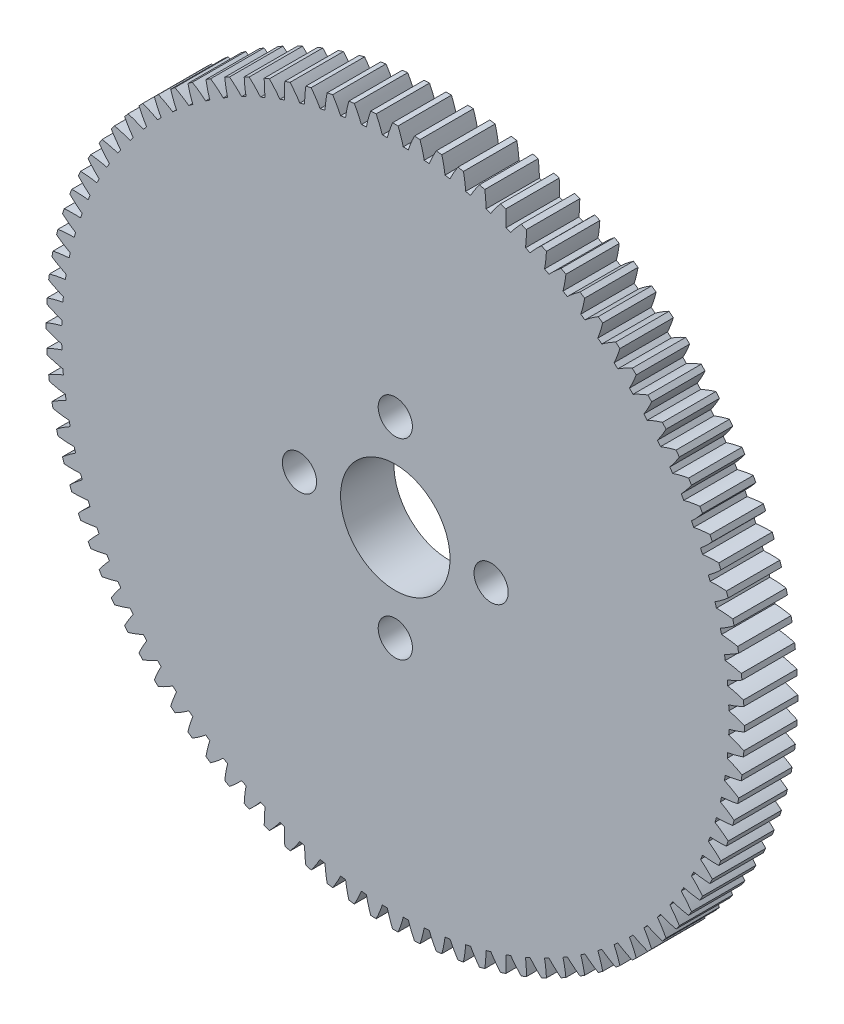
from build123d import *

# Parameters (mm, degrees)
BOSS_EXTRUDE1_DEPTH = 3.9
SKETCH2_R           = 4
SKETCH2_R_2         = 1.25
CUT_EXTRUDE1_DEPTH  = 37.271594327


with BuildPart() as part:
    # Sketch1 → Boss-Extrude1 (new body)
    with BuildSketch(Plane.XY.offset(4)):
        with BuildLine():
            Line((25.499201507, -0.201798183), (25.499201507, 0.201798183))
            ThreePointArc((25.499201507, 0.201798183), (24.94053741, 0.412222952), (24.368062617, 0.581506053))
            ThreePointArc((24.368062617, 0.581506053), (24.362972409, 0.765637253), (24.356490879, 0.949724728))
            ThreePointArc((24.356490879, 0.949724728), (24.917148309, 1.154763051), (25.46155567, 1.39970813))
            Line((25.46155567, 1.39970813), (25.436213645, 1.802508091))
            ThreePointArc((25.436213645, 1.802508091), (24.865439263, 1.977438825), (24.283464745, 2.110441895))
            ThreePointArc((24.283464745, 2.110441895), (24.266822887, 2.293890137), (24.248795199, 2.47720738))
            ThreePointArc((24.248795199, 2.47720738), (24.795471836, 2.717045077), (25.323424706, 2.995690434))
            Line((25.323424706, 2.995690434), (25.272840668, 3.396104322))
            ThreePointArc((25.272840668, 3.396104322), (24.692208588, 3.534850651), (24.103031131, 3.631048787))
            ThreePointArc((24.103031131, 3.631048787), (24.074903302, 3.813090085), (24.045400602, 3.994913625))
            ThreePointArc((24.045400602, 3.994913625), (24.575938965, 4.268604168), (25.085353753, 4.579850117))
            Line((25.085353753, 4.579850117), (25.009727335, 4.976297682))
            ThreePointArc((25.009727335, 4.976297682), (24.421529045, 5.078312037), (23.827473865, 5.137325589))
            ThreePointArc((23.827473865, 5.137325589), (23.787971072, 5.317241509), (23.747109795, 5.496853772))
            ThreePointArc((23.747109795, 5.496853772), (24.25941609, 5.803317028), (24.748282369, 6.145935223))
            Line((24.748282369, 6.145935223), (24.647912034, 6.536851868))
            ThreePointArc((24.647912034, 6.536851868), (24.054468885, 6.601731644), (23.457880446, 6.623327714))
            ThreePointArc((23.457880446, 6.623327714), (23.407158588, 6.80040821), (23.355099994, 6.977100348))
            ThreePointArc((23.355099994, 6.977100348), (23.847152382, 7.315126847), (24.313540822, 7.687765132))
            Line((24.313540822, 7.687765132), (24.188822685, 8.071608086))
            ThreePointArc((24.188822685, 8.071608086), (23.592476726, 8.099097233), (22.995709489, 8.083190589))
            ThreePointArc((22.995709489, 8.083190589), (22.933968743, 8.256736806), (22.870918284, 8.429811496))
            ThreePointArc((22.870918284, 8.429811496), (23.340774859, 8.798067203), (23.782844836, 9.199254943))
            Line((23.782844836, 9.199254943), (23.634271104, 9.574509354))
            ThreePointArc((23.634271104, 9.574509354), (23.037375839, 9.564499385), (22.442784972, 9.511152805))
            ThreePointArc((22.442784972, 9.511152805), (22.370269001, 9.680479834), (22.296475507, 9.84925403))
            ThreePointArc((22.296475507, 9.84925403), (22.742281961, 10.246285607), (23.158288827, 10.674439498))
            Line((23.158288827, 10.674439498), (22.986445852, 11.039624408))
            ThreePointArc((22.986445852, 11.039624408), (22.391356955, 10.992154828), (21.801289037, 10.901578846))
            ThreePointArc((21.801289037, 10.901578846), (21.718284027, 11.066018431), (21.634038729, 11.229826058))
            ThreePointArc((21.634038729, 11.229826058), (22.054035666, 11.654066602), (22.442337633, 12.107496917))
            Line((22.442337633, 12.107496917), (22.2479036, 12.461171109))
            ThreePointArc((22.2479036, 12.461171109), (21.656969615, 12.376429258), (21.073753374, 12.248981335))
            ThreePointArc((21.073753374, 12.248981335), (20.980586908, 12.407884509), (20.886222283, 12.566079093))
            ThreePointArc((20.886222283, 12.566079093), (21.278752168, 13.015854321), (21.637816784, 13.492771577))
            Line((21.637816784, 13.492771577), (21.421559037, 13.833539259))
            ThreePointArc((21.421559037, 13.833539259), (20.837112109, 13.711859575), (20.263049233, 13.548042691))
            ThreePointArc((20.263049233, 13.548042691), (20.160088998, 13.700782335), (20.055977459, 13.852739554))
            ThreePointArc((20.055977459, 13.852739554), (20.419491156, 14.326274409), (20.747901358, 14.824796431))
            Line((20.747901358, 14.824796431), (20.510673366, 15.151312751))
            ThreePointArc((20.510673366, 15.151312751), (19.935020042, 14.993175447), (19.372376095, 14.793636112))
            ThreePointArc((19.372376095, 14.793636112), (19.260028427, 14.939609433), (19.146580856, 15.084729581))
            ThreePointArc((19.146580856, 15.084729581), (19.479643742, 15.580155238), (19.776103444, 16.098314587))
            Line((19.776103444, 16.098314587), (19.518841438, 16.409290932))
            ThreePointArc((19.518841438, 16.409290932), (18.954253558, 16.215320106), (18.405249039, 15.98084581))
            ThreePointArc((18.405249039, 15.98084581), (18.283957322, 16.119476717), (18.161621444, 16.257187072))
            ThreePointArc((18.161621444, 16.257187072), (18.462919073, 16.772548311), (18.726258285, 17.30830005))
            Line((18.726258285, 17.30830005), (18.449977561, 17.60250914))
            ThreePointArc((18.449977561, 17.60250914), (17.898683294, 17.373470304), (17.365484873, 17.104986411))
            ThreePointArc((17.365484873, 17.104986411), (17.235727791, 17.235727791), (17.104986411, 17.365484873))
            ThreePointArc((17.104986411, 17.365484873), (17.373329697, 17.898747799), (17.60250914, 18.449977561))
            Line((17.60250914, 18.449977561), (17.30830005, 18.726258285))
            ThreePointArc((17.30830005, 18.726258285), (16.772475105, 18.463055352), (16.257187072, 18.161621444))
            ThreePointArc((16.257187072, 18.161621444), (16.119476717, 18.283957322), (15.98084581, 18.405249039))
            ThreePointArc((15.98084581, 18.405249039), (16.215175727, 18.954309106), (16.409290932, 19.518841438))
            Line((16.409290932, 19.518841438), (16.098314587, 19.776103444))
            ThreePointArc((16.098314587, 19.776103444), (15.580073619, 19.479775155), (15.084729581, 19.146580856))
            ThreePointArc((15.084729581, 19.146580856), (14.939609433, 19.260028427), (14.793636112, 19.372376095))
            ThreePointArc((14.793636112, 19.372376095), (14.993027865, 19.935066415), (15.151312751, 20.510673366))
            Line((15.151312751, 20.510673366), (14.824796431, 20.747901358))
            ThreePointArc((14.824796431, 20.747901358), (14.3261847, 20.419617185), (13.852739554, 20.055977459))
            ThreePointArc((13.852739554, 20.055977459), (13.700782335, 20.160088998), (13.548042691, 20.263049233))
            ThreePointArc((13.548042691, 20.263049233), (13.711709373, 20.837149124), (13.833539259, 21.421559037))
            Line((13.833539259, 21.421559037), (13.492771577, 21.637816784))
            ThreePointArc((13.492771577, 21.637816784), (13.015756876, 21.278872315), (12.566079093, 20.886222283))
            ThreePointArc((12.566079093, 20.886222283), (12.407884509, 20.980586908), (12.248981335, 21.073753374))
            ThreePointArc((12.248981335, 21.073753374), (12.376277027, 21.656997125), (12.461171109, 22.2479036))
            Line((12.461171109, 22.2479036), (12.107496917, 22.442337633))
            ThreePointArc((12.107496917, 22.442337633), (11.653961805, 22.054149458), (11.229826058, 21.634038729))
            ThreePointArc((11.229826058, 21.634038729), (11.066018431, 21.718284027), (10.901578846, 21.801289037))
            ThreePointArc((10.901578846, 21.801289037), (10.992001171, 22.391374853), (11.039624408, 22.986445852))
            Line((11.039624408, 22.986445852), (10.674439498, 23.158288827))
            ThreePointArc((10.674439498, 23.158288827), (10.246173871, 22.742388948), (9.84925403, 22.296475507))
            ThreePointArc((9.84925403, 22.296475507), (9.680479834, 22.370269001), (9.511152805, 22.442784972))
            ThreePointArc((9.511152805, 22.442784972), (9.564344907, 23.037384054), (9.574509354, 23.634271104))
            Line((9.574509354, 23.634271104), (9.199254943, 23.782844836))
            ThreePointArc((9.199254943, 23.782844836), (8.79794897, 23.340874619), (8.429811496, 22.870918284))
            ThreePointArc((8.429811496, 22.870918284), (8.256736806, 22.933968743), (8.083190589, 22.995709489))
            ThreePointArc((8.083190589, 22.995709489), (8.098942544, 23.592475224), (8.071608086, 24.188822685))
            Line((8.071608086, 24.188822685), (7.687765132, 24.313540822))
            ThreePointArc((7.687765132, 24.313540822), (7.315002584, 23.847244521), (6.977100348, 23.355099994))
            ThreePointArc((6.977100348, 23.355099994), (6.80040821, 23.407158588), (6.623327714, 23.457880446))
            ThreePointArc((6.623327714, 23.457880446), (6.601577355, 24.054457674), (6.536851868, 24.647912034))
            Line((6.536851868, 24.647912034), (6.145935223, 24.748282369))
            ThreePointArc((6.145935223, 24.748282369), (5.803187224, 24.259500244), (5.496853772, 23.747109795))
            ThreePointArc((5.496853772, 23.747109795), (5.317241509, 23.787971072), (5.137325589, 23.827473865))
            ThreePointArc((5.137325589, 23.827473865), (5.078158755, 24.421508168), (4.976297682, 25.009727335))
            Line((4.976297682, 25.009727335), (4.579850117, 25.085353753))
            ThreePointArc((4.579850117, 25.085353753), (4.268469336, 24.576014803), (3.994913625, 24.045400602))
            ThreePointArc((3.994913625, 24.045400602), (3.813090085, 24.074903302), (3.631048787, 24.103031131))
            ThreePointArc((3.631048787, 24.103031131), (3.534698983, 24.692178127), (3.396104322, 25.272840668))
            Line((3.396104322, 25.272840668), (2.995690434, 25.323424706))
            ThreePointArc((2.995690434, 25.323424706), (2.71690575, 24.795539059), (2.47720738, 24.248795199))
            ThreePointArc((2.47720738, 24.248795199), (2.293890137, 24.266822887), (2.110441895, 24.283464745))
            ThreePointArc((2.110441895, 24.283464745), (1.97728937, 24.865399339), (1.802508091, 25.436213645))
            Line((1.802508091, 25.436213645), (1.39970813, 25.46155567))
            ThreePointArc((1.39970813, 25.46155567), (1.154619777, 24.91720665), (0.949724728, 24.356490879))
            ThreePointArc((0.949724728, 24.356490879), (0.765637253, 24.362972409), (0.581506053, 24.368062617))
            ThreePointArc((0.581506053, 24.368062617), (0.412076298, 24.94048818), (0.201798183, 25.499201507))
            Line((0.201798183, 25.499201507), (-0.201798183, 25.499201507))
            ThreePointArc((-0.201798183, 25.499201507), (-0.412222952, 24.94053741), (-0.581506053, 24.368062617))
            ThreePointArc((-0.581506053, 24.368062617), (-0.765637253, 24.362972409), (-0.949724728, 24.356490879))
            ThreePointArc((-0.949724728, 24.356490879), (-1.154763051, 24.917148309), (-1.39970813, 25.46155567))
            Line((-1.39970813, 25.46155567), (-1.802508091, 25.436213645))
            ThreePointArc((-1.802508091, 25.436213645), (-1.977438825, 24.865439263), (-2.110441895, 24.283464745))
            ThreePointArc((-2.110441895, 24.283464745), (-2.293890137, 24.266822887), (-2.47720738, 24.248795199))
            ThreePointArc((-2.47720738, 24.248795199), (-2.717045077, 24.795471836), (-2.995690434, 25.323424706))
            Line((-2.995690434, 25.323424706), (-3.396104322, 25.272840668))
            ThreePointArc((-3.396104322, 25.272840668), (-3.534850651, 24.692208588), (-3.631048787, 24.103031131))
            ThreePointArc((-3.631048787, 24.103031131), (-3.813090085, 24.074903302), (-3.994913625, 24.045400602))
            ThreePointArc((-3.994913625, 24.045400602), (-4.268604168, 24.575938965), (-4.579850117, 25.085353753))
            Line((-4.579850117, 25.085353753), (-4.976297682, 25.009727335))
            ThreePointArc((-4.976297682, 25.009727335), (-5.078312037, 24.421529045), (-5.137325589, 23.827473865))
            ThreePointArc((-5.137325589, 23.827473865), (-5.317241509, 23.787971072), (-5.496853772, 23.747109795))
            ThreePointArc((-5.496853772, 23.747109795), (-5.803317028, 24.25941609), (-6.145935223, 24.748282369))
            Line((-6.145935223, 24.748282369), (-6.536851868, 24.647912034))
            ThreePointArc((-6.536851868, 24.647912034), (-6.601731644, 24.054468885), (-6.623327714, 23.457880446))
            ThreePointArc((-6.623327714, 23.457880446), (-6.80040821, 23.407158588), (-6.977100348, 23.355099994))
            ThreePointArc((-6.977100348, 23.355099994), (-7.315126847, 23.847152382), (-7.687765132, 24.313540822))
            Line((-7.687765132, 24.313540822), (-8.071608086, 24.188822685))
            ThreePointArc((-8.071608086, 24.188822685), (-8.099097233, 23.592476726), (-8.083190589, 22.995709489))
            ThreePointArc((-8.083190589, 22.995709489), (-8.256736806, 22.933968743), (-8.429811496, 22.870918284))
            ThreePointArc((-8.429811496, 22.870918284), (-8.798067203, 23.340774859), (-9.199254943, 23.782844836))
            Line((-9.199254943, 23.782844836), (-9.574509354, 23.634271104))
            ThreePointArc((-9.574509354, 23.634271104), (-9.564499385, 23.037375839), (-9.511152805, 22.442784972))
            ThreePointArc((-9.511152805, 22.442784972), (-9.680479834, 22.370269001), (-9.84925403, 22.296475507))
            ThreePointArc((-9.84925403, 22.296475507), (-10.246285607, 22.742281961), (-10.674439498, 23.158288827))
            Line((-10.674439498, 23.158288827), (-11.039624408, 22.986445852))
            ThreePointArc((-11.039624408, 22.986445852), (-10.992154828, 22.391356955), (-10.901578846, 21.801289037))
            ThreePointArc((-10.901578846, 21.801289037), (-11.066018431, 21.718284027), (-11.229826058, 21.634038729))
            ThreePointArc((-11.229826058, 21.634038729), (-11.654066602, 22.054035666), (-12.107496917, 22.442337633))
            Line((-12.107496917, 22.442337633), (-12.461171109, 22.2479036))
            ThreePointArc((-12.461171109, 22.2479036), (-12.376429258, 21.656969615), (-12.248981335, 21.073753374))
            ThreePointArc((-12.248981335, 21.073753374), (-12.407884509, 20.980586908), (-12.566079093, 20.886222283))
            ThreePointArc((-12.566079093, 20.886222283), (-13.015854321, 21.278752168), (-13.492771577, 21.637816784))
            Line((-13.492771577, 21.637816784), (-13.833539259, 21.421559037))
            ThreePointArc((-13.833539259, 21.421559037), (-13.711859575, 20.837112109), (-13.548042691, 20.263049233))
            ThreePointArc((-13.548042691, 20.263049233), (-13.700782335, 20.160088998), (-13.852739554, 20.055977459))
            ThreePointArc((-13.852739554, 20.055977459), (-14.326274409, 20.419491156), (-14.824796431, 20.747901358))
            Line((-14.824796431, 20.747901358), (-15.151312751, 20.510673366))
            ThreePointArc((-15.151312751, 20.510673366), (-14.993175447, 19.935020042), (-14.793636112, 19.372376095))
            ThreePointArc((-14.793636112, 19.372376095), (-14.939609433, 19.260028427), (-15.084729581, 19.146580856))
            ThreePointArc((-15.084729581, 19.146580856), (-15.580155238, 19.479643742), (-16.098314587, 19.776103444))
            Line((-16.098314587, 19.776103444), (-16.409290932, 19.518841438))
            ThreePointArc((-16.409290932, 19.518841438), (-16.215320106, 18.954253558), (-15.98084581, 18.405249039))
            ThreePointArc((-15.98084581, 18.405249039), (-16.119476717, 18.283957322), (-16.257187072, 18.161621444))
            ThreePointArc((-16.257187072, 18.161621444), (-16.772548311, 18.462919073), (-17.30830005, 18.726258285))
            Line((-17.30830005, 18.726258285), (-17.60250914, 18.449977561))
            ThreePointArc((-17.60250914, 18.449977561), (-17.373470304, 17.898683294), (-17.104986411, 17.365484873))
            ThreePointArc((-17.104986411, 17.365484873), (-17.235727791, 17.235727791), (-17.365484873, 17.104986411))
            ThreePointArc((-17.365484873, 17.104986411), (-17.898747799, 17.373329697), (-18.449977561, 17.60250914))
            Line((-18.449977561, 17.60250914), (-18.726258285, 17.30830005))
            ThreePointArc((-18.726258285, 17.30830005), (-18.463055352, 16.772475105), (-18.161621444, 16.257187072))
            ThreePointArc((-18.161621444, 16.257187072), (-18.283957322, 16.119476717), (-18.405249039, 15.98084581))
            ThreePointArc((-18.405249039, 15.98084581), (-18.954309106, 16.215175727), (-19.518841438, 16.409290932))
            Line((-19.518841438, 16.409290932), (-19.776103444, 16.098314587))
            ThreePointArc((-19.776103444, 16.098314587), (-19.479775155, 15.580073619), (-19.146580856, 15.084729581))
            ThreePointArc((-19.146580856, 15.084729581), (-19.260028427, 14.939609433), (-19.372376095, 14.793636112))
            ThreePointArc((-19.372376095, 14.793636112), (-19.935066415, 14.993027865), (-20.510673366, 15.151312751))
            Line((-20.510673366, 15.151312751), (-20.747901358, 14.824796431))
            ThreePointArc((-20.747901358, 14.824796431), (-20.419617185, 14.3261847), (-20.055977459, 13.852739554))
            ThreePointArc((-20.055977459, 13.852739554), (-20.160088998, 13.700782335), (-20.263049233, 13.548042691))
            ThreePointArc((-20.263049233, 13.548042691), (-20.837149124, 13.711709373), (-21.421559037, 13.833539259))
            Line((-21.421559037, 13.833539259), (-21.637816784, 13.492771577))
            ThreePointArc((-21.637816784, 13.492771577), (-21.278872315, 13.015756876), (-20.886222283, 12.566079093))
            ThreePointArc((-20.886222283, 12.566079093), (-20.980586908, 12.407884509), (-21.073753374, 12.248981335))
            ThreePointArc((-21.073753374, 12.248981335), (-21.656997125, 12.376277027), (-22.2479036, 12.461171109))
            Line((-22.2479036, 12.461171109), (-22.442337633, 12.107496917))
            ThreePointArc((-22.442337633, 12.107496917), (-22.054149458, 11.653961805), (-21.634038729, 11.229826058))
            ThreePointArc((-21.634038729, 11.229826058), (-21.718284027, 11.066018431), (-21.801289037, 10.901578846))
            ThreePointArc((-21.801289037, 10.901578846), (-22.391374853, 10.992001171), (-22.986445852, 11.039624408))
            Line((-22.986445852, 11.039624408), (-23.158288827, 10.674439498))
            ThreePointArc((-23.158288827, 10.674439498), (-22.742388948, 10.246173871), (-22.296475507, 9.84925403))
            ThreePointArc((-22.296475507, 9.84925403), (-22.370269001, 9.680479834), (-22.442784972, 9.511152805))
            ThreePointArc((-22.442784972, 9.511152805), (-23.037384054, 9.564344907), (-23.634271104, 9.574509354))
            Line((-23.634271104, 9.574509354), (-23.782844836, 9.199254943))
            ThreePointArc((-23.782844836, 9.199254943), (-23.340874619, 8.79794897), (-22.870918284, 8.429811496))
            ThreePointArc((-22.870918284, 8.429811496), (-22.933968743, 8.256736806), (-22.995709489, 8.083190589))
            ThreePointArc((-22.995709489, 8.083190589), (-23.592475224, 8.098942544), (-24.188822685, 8.071608086))
            Line((-24.188822685, 8.071608086), (-24.313540822, 7.687765132))
            ThreePointArc((-24.313540822, 7.687765132), (-23.847244521, 7.315002584), (-23.355099994, 6.977100348))
            ThreePointArc((-23.355099994, 6.977100348), (-23.407158588, 6.80040821), (-23.457880446, 6.623327714))
            ThreePointArc((-23.457880446, 6.623327714), (-24.054457674, 6.601577355), (-24.647912034, 6.536851868))
            Line((-24.647912034, 6.536851868), (-24.748282369, 6.145935223))
            ThreePointArc((-24.748282369, 6.145935223), (-24.259500244, 5.803187224), (-23.747109795, 5.496853772))
            ThreePointArc((-23.747109795, 5.496853772), (-23.787971072, 5.317241509), (-23.827473865, 5.137325589))
            ThreePointArc((-23.827473865, 5.137325589), (-24.421508168, 5.078158755), (-25.009727335, 4.976297682))
            Line((-25.009727335, 4.976297682), (-25.085353753, 4.579850117))
            ThreePointArc((-25.085353753, 4.579850117), (-24.576014803, 4.268469336), (-24.045400602, 3.994913625))
            ThreePointArc((-24.045400602, 3.994913625), (-24.074903302, 3.813090085), (-24.103031131, 3.631048787))
            ThreePointArc((-24.103031131, 3.631048787), (-24.692178127, 3.534698983), (-25.272840668, 3.396104322))
            Line((-25.272840668, 3.396104322), (-25.323424706, 2.995690434))
            ThreePointArc((-25.323424706, 2.995690434), (-24.795539059, 2.71690575), (-24.248795199, 2.47720738))
            ThreePointArc((-24.248795199, 2.47720738), (-24.266822887, 2.293890137), (-24.283464745, 2.110441895))
            ThreePointArc((-24.283464745, 2.110441895), (-24.865399339, 1.97728937), (-25.436213645, 1.802508091))
            Line((-25.436213645, 1.802508091), (-25.46155567, 1.39970813))
            ThreePointArc((-25.46155567, 1.39970813), (-24.91720665, 1.154619777), (-24.356490879, 0.949724728))
            ThreePointArc((-24.356490879, 0.949724728), (-24.362972409, 0.765637253), (-24.368062617, 0.581506053))
            ThreePointArc((-24.368062617, 0.581506053), (-24.94048818, 0.412076298), (-25.499201507, 0.201798183))
            Line((-25.499201507, 0.201798183), (-25.499201507, -0.201798183))
            ThreePointArc((-25.499201507, -0.201798183), (-24.94053741, -0.412222952), (-24.368062617, -0.581506053))
            ThreePointArc((-24.368062617, -0.581506053), (-24.362972409, -0.765637253), (-24.356490879, -0.949724728))
            ThreePointArc((-24.356490879, -0.949724728), (-24.917148309, -1.154763051), (-25.46155567, -1.39970813))
            Line((-25.46155567, -1.39970813), (-25.436213645, -1.802508091))
            ThreePointArc((-25.436213645, -1.802508091), (-24.865439263, -1.977438825), (-24.283464745, -2.110441895))
            ThreePointArc((-24.283464745, -2.110441895), (-24.266822887, -2.293890137), (-24.248795199, -2.47720738))
            ThreePointArc((-24.248795199, -2.47720738), (-24.795471836, -2.717045077), (-25.323424706, -2.995690434))
            Line((-25.323424706, -2.995690434), (-25.272840668, -3.396104322))
            ThreePointArc((-25.272840668, -3.396104322), (-24.692208588, -3.534850651), (-24.103031131, -3.631048787))
            ThreePointArc((-24.103031131, -3.631048787), (-24.074903302, -3.813090085), (-24.045400602, -3.994913625))
            ThreePointArc((-24.045400602, -3.994913625), (-24.575938965, -4.268604168), (-25.085353753, -4.579850117))
            Line((-25.085353753, -4.579850117), (-25.009727335, -4.976297682))
            ThreePointArc((-25.009727335, -4.976297682), (-24.421529045, -5.078312037), (-23.827473865, -5.137325589))
            ThreePointArc((-23.827473865, -5.137325589), (-23.787971072, -5.317241509), (-23.747109795, -5.496853772))
            ThreePointArc((-23.747109795, -5.496853772), (-24.25941609, -5.803317028), (-24.748282369, -6.145935223))
            Line((-24.748282369, -6.145935223), (-24.647912034, -6.536851868))
            ThreePointArc((-24.647912034, -6.536851868), (-24.054468885, -6.601731644), (-23.457880446, -6.623327714))
            ThreePointArc((-23.457880446, -6.623327714), (-23.407158588, -6.80040821), (-23.355099994, -6.977100348))
            ThreePointArc((-23.355099994, -6.977100348), (-23.847152382, -7.315126847), (-24.313540822, -7.687765132))
            Line((-24.313540822, -7.687765132), (-24.188822685, -8.071608086))
            ThreePointArc((-24.188822685, -8.071608086), (-23.592476726, -8.099097233), (-22.995709489, -8.083190589))
            ThreePointArc((-22.995709489, -8.083190589), (-22.933968743, -8.256736806), (-22.870918284, -8.429811496))
            ThreePointArc((-22.870918284, -8.429811496), (-23.340774859, -8.798067203), (-23.782844836, -9.199254943))
            Line((-23.782844836, -9.199254943), (-23.634271104, -9.574509354))
            ThreePointArc((-23.634271104, -9.574509354), (-23.037375839, -9.564499385), (-22.442784972, -9.511152805))
            ThreePointArc((-22.442784972, -9.511152805), (-22.370269001, -9.680479834), (-22.296475507, -9.84925403))
            ThreePointArc((-22.296475507, -9.84925403), (-22.742281961, -10.246285607), (-23.158288827, -10.674439498))
            Line((-23.158288827, -10.674439498), (-22.986445852, -11.039624408))
            ThreePointArc((-22.986445852, -11.039624408), (-22.391356955, -10.992154828), (-21.801289037, -10.901578846))
            ThreePointArc((-21.801289037, -10.901578846), (-21.718284027, -11.066018431), (-21.634038729, -11.229826058))
            ThreePointArc((-21.634038729, -11.229826058), (-22.054035666, -11.654066602), (-22.442337633, -12.107496917))
            Line((-22.442337633, -12.107496917), (-22.2479036, -12.461171109))
            ThreePointArc((-22.2479036, -12.461171109), (-21.656969615, -12.376429258), (-21.073753374, -12.248981335))
            ThreePointArc((-21.073753374, -12.248981335), (-20.980586908, -12.407884509), (-20.886222283, -12.566079093))
            ThreePointArc((-20.886222283, -12.566079093), (-21.278752168, -13.015854321), (-21.637816784, -13.492771577))
            Line((-21.637816784, -13.492771577), (-21.421559037, -13.833539259))
            ThreePointArc((-21.421559037, -13.833539259), (-20.837112109, -13.711859575), (-20.263049233, -13.548042691))
            ThreePointArc((-20.263049233, -13.548042691), (-20.160088998, -13.700782335), (-20.055977459, -13.852739554))
            ThreePointArc((-20.055977459, -13.852739554), (-20.419491156, -14.326274409), (-20.747901358, -14.824796431))
            Line((-20.747901358, -14.824796431), (-20.510673366, -15.151312751))
            ThreePointArc((-20.510673366, -15.151312751), (-19.935020042, -14.993175447), (-19.372376095, -14.793636112))
            ThreePointArc((-19.372376095, -14.793636112), (-19.260028427, -14.939609433), (-19.146580856, -15.084729581))
            ThreePointArc((-19.146580856, -15.084729581), (-19.479643742, -15.580155238), (-19.776103444, -16.098314587))
            Line((-19.776103444, -16.098314587), (-19.518841438, -16.409290932))
            ThreePointArc((-19.518841438, -16.409290932), (-18.954253558, -16.215320106), (-18.405249039, -15.98084581))
            ThreePointArc((-18.405249039, -15.98084581), (-18.283957322, -16.119476717), (-18.161621444, -16.257187072))
            ThreePointArc((-18.161621444, -16.257187072), (-18.462919073, -16.772548311), (-18.726258285, -17.30830005))
            Line((-18.726258285, -17.30830005), (-18.449977561, -17.60250914))
            ThreePointArc((-18.449977561, -17.60250914), (-17.898683294, -17.373470304), (-17.365484873, -17.104986411))
            ThreePointArc((-17.365484873, -17.104986411), (-17.235727791, -17.235727791), (-17.104986411, -17.365484873))
            ThreePointArc((-17.104986411, -17.365484873), (-17.373329697, -17.898747799), (-17.60250914, -18.449977561))
            Line((-17.60250914, -18.449977561), (-17.30830005, -18.726258285))
            ThreePointArc((-17.30830005, -18.726258285), (-16.772475105, -18.463055352), (-16.257187072, -18.161621444))
            ThreePointArc((-16.257187072, -18.161621444), (-16.119476717, -18.283957322), (-15.98084581, -18.405249039))
            ThreePointArc((-15.98084581, -18.405249039), (-16.215175727, -18.954309106), (-16.409290932, -19.518841438))
            Line((-16.409290932, -19.518841438), (-16.098314587, -19.776103444))
            ThreePointArc((-16.098314587, -19.776103444), (-15.580073619, -19.479775155), (-15.084729581, -19.146580856))
            ThreePointArc((-15.084729581, -19.146580856), (-14.939609433, -19.260028427), (-14.793636112, -19.372376095))
            ThreePointArc((-14.793636112, -19.372376095), (-14.993027865, -19.935066415), (-15.151312751, -20.510673366))
            Line((-15.151312751, -20.510673366), (-14.824796431, -20.747901358))
            ThreePointArc((-14.824796431, -20.747901358), (-14.3261847, -20.419617185), (-13.852739554, -20.055977459))
            ThreePointArc((-13.852739554, -20.055977459), (-13.700782335, -20.160088998), (-13.548042691, -20.263049233))
            ThreePointArc((-13.548042691, -20.263049233), (-13.711709373, -20.837149124), (-13.833539259, -21.421559037))
            Line((-13.833539259, -21.421559037), (-13.492771577, -21.637816784))
            ThreePointArc((-13.492771577, -21.637816784), (-13.015756876, -21.278872315), (-12.566079093, -20.886222283))
            ThreePointArc((-12.566079093, -20.886222283), (-12.407884509, -20.980586908), (-12.248981335, -21.073753374))
            ThreePointArc((-12.248981335, -21.073753374), (-12.376277027, -21.656997125), (-12.461171109, -22.2479036))
            Line((-12.461171109, -22.2479036), (-12.107496917, -22.442337633))
            ThreePointArc((-12.107496917, -22.442337633), (-11.653961805, -22.054149458), (-11.229826058, -21.634038729))
            ThreePointArc((-11.229826058, -21.634038729), (-11.066018431, -21.718284027), (-10.901578846, -21.801289037))
            ThreePointArc((-10.901578846, -21.801289037), (-10.992001171, -22.391374853), (-11.039624408, -22.986445852))
            Line((-11.039624408, -22.986445852), (-10.674439498, -23.158288827))
            ThreePointArc((-10.674439498, -23.158288827), (-10.246173871, -22.742388948), (-9.84925403, -22.296475507))
            ThreePointArc((-9.84925403, -22.296475507), (-9.680479834, -22.370269001), (-9.511152805, -22.442784972))
            ThreePointArc((-9.511152805, -22.442784972), (-9.564344907, -23.037384054), (-9.574509354, -23.634271104))
            Line((-9.574509354, -23.634271104), (-9.199254943, -23.782844836))
            ThreePointArc((-9.199254943, -23.782844836), (-8.79794897, -23.340874619), (-8.429811496, -22.870918284))
            ThreePointArc((-8.429811496, -22.870918284), (-8.256736806, -22.933968743), (-8.083190589, -22.995709489))
            ThreePointArc((-8.083190589, -22.995709489), (-8.098942544, -23.592475224), (-8.071608086, -24.188822685))
            Line((-8.071608086, -24.188822685), (-7.687765132, -24.313540822))
            ThreePointArc((-7.687765132, -24.313540822), (-7.315002584, -23.847244521), (-6.977100348, -23.355099994))
            ThreePointArc((-6.977100348, -23.355099994), (-6.80040821, -23.407158588), (-6.623327714, -23.457880446))
            ThreePointArc((-6.623327714, -23.457880446), (-6.601577355, -24.054457674), (-6.536851868, -24.647912034))
            Line((-6.536851868, -24.647912034), (-6.145935223, -24.748282369))
            ThreePointArc((-6.145935223, -24.748282369), (-5.803187224, -24.259500244), (-5.496853772, -23.747109795))
            ThreePointArc((-5.496853772, -23.747109795), (-5.317241509, -23.787971072), (-5.137325589, -23.827473865))
            ThreePointArc((-5.137325589, -23.827473865), (-5.078158755, -24.421508168), (-4.976297682, -25.009727335))
            Line((-4.976297682, -25.009727335), (-4.579850117, -25.085353753))
            ThreePointArc((-4.579850117, -25.085353753), (-4.268469336, -24.576014803), (-3.994913625, -24.045400602))
            ThreePointArc((-3.994913625, -24.045400602), (-3.813090085, -24.074903302), (-3.631048787, -24.103031131))
            ThreePointArc((-3.631048787, -24.103031131), (-3.534698983, -24.692178127), (-3.396104322, -25.272840668))
            Line((-3.396104322, -25.272840668), (-2.995690434, -25.323424706))
            ThreePointArc((-2.995690434, -25.323424706), (-2.71690575, -24.795539059), (-2.47720738, -24.248795199))
            ThreePointArc((-2.47720738, -24.248795199), (-2.293890137, -24.266822887), (-2.110441895, -24.283464745))
            ThreePointArc((-2.110441895, -24.283464745), (-1.97728937, -24.865399339), (-1.802508091, -25.436213645))
            Line((-1.802508091, -25.436213645), (-1.39970813, -25.46155567))
            ThreePointArc((-1.39970813, -25.46155567), (-1.154619777, -24.91720665), (-0.949724728, -24.356490879))
            ThreePointArc((-0.949724728, -24.356490879), (-0.765637253, -24.362972409), (-0.581506053, -24.368062617))
            ThreePointArc((-0.581506053, -24.368062617), (-0.412076298, -24.94048818), (-0.201798183, -25.499201507))
            Line((-0.201798183, -25.499201507), (0.201798183, -25.499201507))
            ThreePointArc((0.201798183, -25.499201507), (0.412222952, -24.94053741), (0.581506053, -24.368062617))
            ThreePointArc((0.581506053, -24.368062617), (0.765637253, -24.362972409), (0.949724728, -24.356490879))
            ThreePointArc((0.949724728, -24.356490879), (1.154763051, -24.917148309), (1.39970813, -25.46155567))
            Line((1.39970813, -25.46155567), (1.802508091, -25.436213645))
            ThreePointArc((1.802508091, -25.436213645), (1.977438825, -24.865439263), (2.110441895, -24.283464745))
            ThreePointArc((2.110441895, -24.283464745), (2.293890137, -24.266822887), (2.47720738, -24.248795199))
            ThreePointArc((2.47720738, -24.248795199), (2.717045077, -24.795471836), (2.995690434, -25.323424706))
            Line((2.995690434, -25.323424706), (3.396104322, -25.272840668))
            ThreePointArc((3.396104322, -25.272840668), (3.534850651, -24.692208588), (3.631048787, -24.103031131))
            ThreePointArc((3.631048787, -24.103031131), (3.813090085, -24.074903302), (3.994913625, -24.045400602))
            ThreePointArc((3.994913625, -24.045400602), (4.268604168, -24.575938965), (4.579850117, -25.085353753))
            Line((4.579850117, -25.085353753), (4.976297682, -25.009727335))
            ThreePointArc((4.976297682, -25.009727335), (5.078312037, -24.421529045), (5.137325589, -23.827473865))
            ThreePointArc((5.137325589, -23.827473865), (5.317241509, -23.787971072), (5.496853772, -23.747109795))
            ThreePointArc((5.496853772, -23.747109795), (5.803317028, -24.25941609), (6.145935223, -24.748282369))
            Line((6.145935223, -24.748282369), (6.536851868, -24.647912034))
            ThreePointArc((6.536851868, -24.647912034), (6.601731644, -24.054468885), (6.623327714, -23.457880446))
            ThreePointArc((6.623327714, -23.457880446), (6.80040821, -23.407158588), (6.977100348, -23.355099994))
            ThreePointArc((6.977100348, -23.355099994), (7.315126847, -23.847152382), (7.687765132, -24.313540822))
            Line((7.687765132, -24.313540822), (8.071608086, -24.188822685))
            ThreePointArc((8.071608086, -24.188822685), (8.099097233, -23.592476726), (8.083190589, -22.995709489))
            ThreePointArc((8.083190589, -22.995709489), (8.256736806, -22.933968743), (8.429811496, -22.870918284))
            ThreePointArc((8.429811496, -22.870918284), (8.798067203, -23.340774859), (9.199254943, -23.782844836))
            Line((9.199254943, -23.782844836), (9.574509354, -23.634271104))
            ThreePointArc((9.574509354, -23.634271104), (9.564499385, -23.037375839), (9.511152805, -22.442784972))
            ThreePointArc((9.511152805, -22.442784972), (9.680479834, -22.370269001), (9.84925403, -22.296475507))
            ThreePointArc((9.84925403, -22.296475507), (10.246285607, -22.742281961), (10.674439498, -23.158288827))
            Line((10.674439498, -23.158288827), (11.039624408, -22.986445852))
            ThreePointArc((11.039624408, -22.986445852), (10.992154828, -22.391356955), (10.901578846, -21.801289037))
            ThreePointArc((10.901578846, -21.801289037), (11.066018431, -21.718284027), (11.229826058, -21.634038729))
            ThreePointArc((11.229826058, -21.634038729), (11.654066602, -22.054035666), (12.107496917, -22.442337633))
            Line((12.107496917, -22.442337633), (12.461171109, -22.2479036))
            ThreePointArc((12.461171109, -22.2479036), (12.376429258, -21.656969615), (12.248981335, -21.073753374))
            ThreePointArc((12.248981335, -21.073753374), (12.407884509, -20.980586908), (12.566079093, -20.886222283))
            ThreePointArc((12.566079093, -20.886222283), (13.015854321, -21.278752168), (13.492771577, -21.637816784))
            Line((13.492771577, -21.637816784), (13.833539259, -21.421559037))
            ThreePointArc((13.833539259, -21.421559037), (13.711859575, -20.837112109), (13.548042691, -20.263049233))
            ThreePointArc((13.548042691, -20.263049233), (13.700782335, -20.160088998), (13.852739554, -20.055977459))
            ThreePointArc((13.852739554, -20.055977459), (14.326274409, -20.419491156), (14.824796431, -20.747901358))
            Line((14.824796431, -20.747901358), (15.151312751, -20.510673366))
            ThreePointArc((15.151312751, -20.510673366), (14.993175447, -19.935020042), (14.793636112, -19.372376095))
            ThreePointArc((14.793636112, -19.372376095), (14.939609433, -19.260028427), (15.084729581, -19.146580856))
            ThreePointArc((15.084729581, -19.146580856), (15.580155238, -19.479643742), (16.098314587, -19.776103444))
            Line((16.098314587, -19.776103444), (16.409290932, -19.518841438))
            ThreePointArc((16.409290932, -19.518841438), (16.215320106, -18.954253558), (15.98084581, -18.405249039))
            ThreePointArc((15.98084581, -18.405249039), (16.119476717, -18.283957322), (16.257187072, -18.161621444))
            ThreePointArc((16.257187072, -18.161621444), (16.772548311, -18.462919073), (17.30830005, -18.726258285))
            Line((17.30830005, -18.726258285), (17.60250914, -18.449977561))
            ThreePointArc((17.60250914, -18.449977561), (17.373470304, -17.898683294), (17.104986411, -17.365484873))
            ThreePointArc((17.104986411, -17.365484873), (17.235727791, -17.235727791), (17.365484873, -17.104986411))
            ThreePointArc((17.365484873, -17.104986411), (17.898747799, -17.373329697), (18.449977561, -17.60250914))
            Line((18.449977561, -17.60250914), (18.726258285, -17.30830005))
            ThreePointArc((18.726258285, -17.30830005), (18.463055352, -16.772475105), (18.161621444, -16.257187072))
            ThreePointArc((18.161621444, -16.257187072), (18.283957322, -16.119476717), (18.405249039, -15.98084581))
            ThreePointArc((18.405249039, -15.98084581), (18.954309106, -16.215175727), (19.518841438, -16.409290932))
            Line((19.518841438, -16.409290932), (19.776103444, -16.098314587))
            ThreePointArc((19.776103444, -16.098314587), (19.479775155, -15.580073619), (19.146580856, -15.084729581))
            ThreePointArc((19.146580856, -15.084729581), (19.260028427, -14.939609433), (19.372376095, -14.793636112))
            ThreePointArc((19.372376095, -14.793636112), (19.935066415, -14.993027865), (20.510673366, -15.151312751))
            Line((20.510673366, -15.151312751), (20.747901358, -14.824796431))
            ThreePointArc((20.747901358, -14.824796431), (20.419617185, -14.3261847), (20.055977459, -13.852739554))
            ThreePointArc((20.055977459, -13.852739554), (20.160088998, -13.700782335), (20.263049233, -13.548042691))
            ThreePointArc((20.263049233, -13.548042691), (20.837149124, -13.711709373), (21.421559037, -13.833539259))
            Line((21.421559037, -13.833539259), (21.637816784, -13.492771577))
            ThreePointArc((21.637816784, -13.492771577), (21.278872315, -13.015756876), (20.886222283, -12.566079093))
            ThreePointArc((20.886222283, -12.566079093), (20.980586908, -12.407884509), (21.073753374, -12.248981335))
            ThreePointArc((21.073753374, -12.248981335), (21.656997125, -12.376277027), (22.2479036, -12.461171109))
            Line((22.2479036, -12.461171109), (22.442337633, -12.107496917))
            ThreePointArc((22.442337633, -12.107496917), (22.054149458, -11.653961805), (21.634038729, -11.229826058))
            ThreePointArc((21.634038729, -11.229826058), (21.718284027, -11.066018431), (21.801289037, -10.901578846))
            ThreePointArc((21.801289037, -10.901578846), (22.391374853, -10.992001171), (22.986445852, -11.039624408))
            Line((22.986445852, -11.039624408), (23.158288827, -10.674439498))
            ThreePointArc((23.158288827, -10.674439498), (22.742388948, -10.246173871), (22.296475507, -9.84925403))
            ThreePointArc((22.296475507, -9.84925403), (22.370269001, -9.680479834), (22.442784972, -9.511152805))
            ThreePointArc((22.442784972, -9.511152805), (23.037384054, -9.564344907), (23.634271104, -9.574509354))
            Line((23.634271104, -9.574509354), (23.782844836, -9.199254943))
            ThreePointArc((23.782844836, -9.199254943), (23.340874619, -8.79794897), (22.870918284, -8.429811496))
            ThreePointArc((22.870918284, -8.429811496), (22.933968743, -8.256736806), (22.995709489, -8.083190589))
            ThreePointArc((22.995709489, -8.083190589), (23.592475224, -8.098942544), (24.188822685, -8.071608086))
            Line((24.188822685, -8.071608086), (24.313540822, -7.687765132))
            ThreePointArc((24.313540822, -7.687765132), (23.847244521, -7.315002584), (23.355099994, -6.977100348))
            ThreePointArc((23.355099994, -6.977100348), (23.407158588, -6.80040821), (23.457880446, -6.623327714))
            ThreePointArc((23.457880446, -6.623327714), (24.054457674, -6.601577355), (24.647912034, -6.536851868))
            Line((24.647912034, -6.536851868), (24.748282369, -6.145935223))
            ThreePointArc((24.748282369, -6.145935223), (24.259500244, -5.803187224), (23.747109795, -5.496853772))
            ThreePointArc((23.747109795, -5.496853772), (23.787971072, -5.317241509), (23.827473865, -5.137325589))
            ThreePointArc((23.827473865, -5.137325589), (24.421508168, -5.078158755), (25.009727335, -4.976297682))
            Line((25.009727335, -4.976297682), (25.085353753, -4.579850117))
            ThreePointArc((25.085353753, -4.579850117), (24.576014803, -4.268469336), (24.045400602, -3.994913625))
            ThreePointArc((24.045400602, -3.994913625), (24.074903302, -3.813090085), (24.103031131, -3.631048787))
            ThreePointArc((24.103031131, -3.631048787), (24.692178127, -3.534698983), (25.272840668, -3.396104322))
            Line((25.272840668, -3.396104322), (25.323424706, -2.995690434))
            ThreePointArc((25.323424706, -2.995690434), (24.795539059, -2.71690575), (24.248795199, -2.47720738))
            ThreePointArc((24.248795199, -2.47720738), (24.266822887, -2.293890137), (24.283464745, -2.110441895))
            ThreePointArc((24.283464745, -2.110441895), (24.865399339, -1.97728937), (25.436213645, -1.802508091))
            Line((25.436213645, -1.802508091), (25.46155567, -1.39970813))
            ThreePointArc((25.46155567, -1.39970813), (24.91720665, -1.154619777), (24.356490879, -0.949724728))
            ThreePointArc((24.356490879, -0.949724728), (24.362972409, -0.765637253), (24.368062617, -0.581506053))
            ThreePointArc((24.368062617, -0.581506053), (24.94048818, -0.412076298), (25.499201507, -0.201798183))
        make_face()
    extrude(amount=-BOSS_EXTRUDE1_DEPTH)

    # Sketch2 → Cut-Extrude1 (cut, through all)
    with BuildSketch(Plane.XY.offset(4)):
        Circle(SKETCH2_R)
        with Locations((0, 7)):
            Circle(SKETCH2_R_2)
        with Locations((7, 0)):
            Circle(SKETCH2_R_2)
        with Locations((0, -7)):
            Circle(SKETCH2_R_2)
        with Locations((-7, 0)):
            Circle(SKETCH2_R_2)
    extrude(amount=-CUT_EXTRUDE1_DEPTH, mode=Mode.SUBTRACT)


solid = part.part
